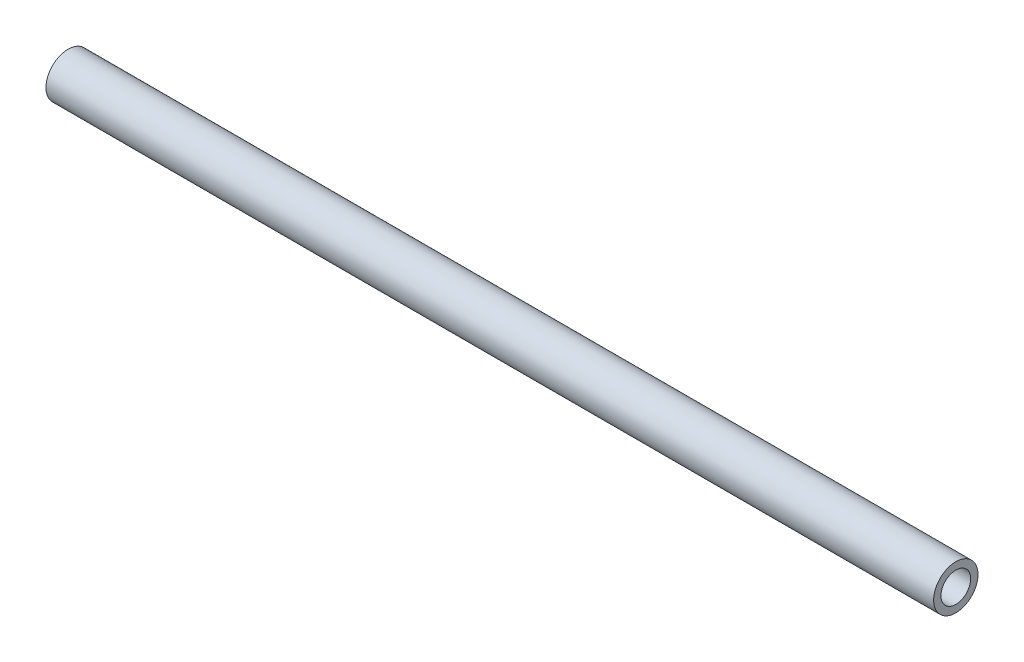
from build123d import *

# Parameters (mm, degrees)
SKETCH1_R           = 3.175
SKETCH1_R_2         = 2.12725
BOSS_EXTRUDE1_DEPTH = 127


with BuildPart() as part:
    # Sketch1 → Boss-Extrude1 (new body)
    with BuildSketch(Plane(origin=(0, 0, 0), x_dir=(0, 0, -1), z_dir=(1, 0, 0))):
        Circle(SKETCH1_R)
        Circle(SKETCH1_R_2, mode=Mode.SUBTRACT)
    extrude(amount=BOSS_EXTRUDE1_DEPTH)


solid = part.part
